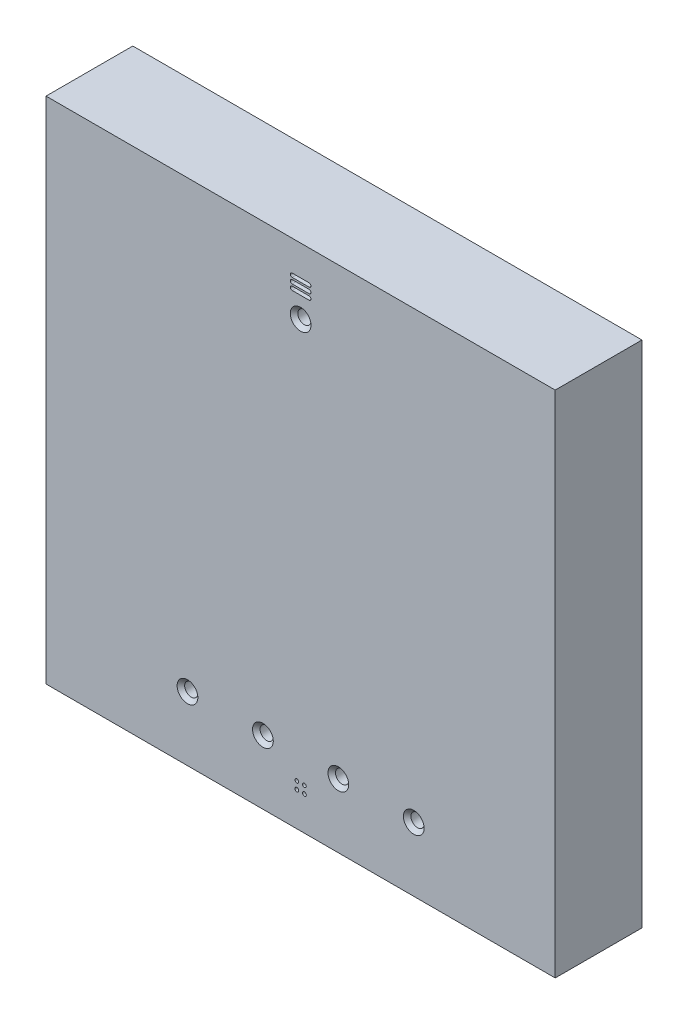
from build123d import *

# Parameters (mm, degrees)
SKIZZE1_W                       = 135
SKIZZE1_H                       = 135
SKIZZE1_W_2                     = 131
SKIZZE1_H_2                     = 131
AUFSATZ_LINEAR_AUSTRAGEN1_DEPTH = 18
SKIZZE2_W                       = 135
SKIZZE2_H                       = 135
AUFSATZ_LINEAR_AUSTRAGEN2_DEPTH = 5
SCHNITT_LINEAR_AUSTRAGEN1_DEPTH = 11
SKIZZE4_R                       = 1.75
SKIZZE4_R_2                     = 0.5
SCHNITT_LINEAR_AUSTRAGEN2_DEPTH = 10
FASE1_SIZE                      = 1


with BuildPart() as part:
    # Skizze1 → Aufsatz-Linear austragen1 (new body)
    with BuildSketch(Plane.XY):
        Rectangle(SKIZZE1_W, SKIZZE1_H)
        Rectangle(SKIZZE1_W_2, SKIZZE1_H_2, mode=Mode.SUBTRACT)
    extrude(amount=AUFSATZ_LINEAR_AUSTRAGEN1_DEPTH)

    # Skizze2 → Aufsatz-Linear austragen2 (add)
    with BuildSketch(Plane.XY.offset(18)):
        Rectangle(SKIZZE2_W, SKIZZE2_H)
    extrude(amount=AUFSATZ_LINEAR_AUSTRAGEN2_DEPTH)

    # Skizze3 → Schnitt-Linear austragen1 (cut)
    with BuildSketch(Plane.ZY.offset(67.5)):
        Polygon((5, -33.148996127), (3, -33.148996127), (3, -41.848996127), (5, -41.848996127), (7.4, -41.848996127), (7.4, -33.148996127), align=None)
    extrude(amount=-SCHNITT_LINEAR_AUSTRAGEN1_DEPTH, mode=Mode.SUBTRACT)

    # Skizze4 → Schnitt-Linear austragen2 (cut)
    with BuildSketch(Plane.XY.offset(23)):
        with BuildLine():
            Line((2.25, 56.5), (-2.25, 56.5))
            ThreePointArc((-2.25, 56.5), (-2.75, 56), (-2.25, 55.5))
            Line((-2.25, 55.5), (2.25, 55.5))
            ThreePointArc((2.25, 55.5), (2.75, 56), (2.25, 56.5))
        make_face()
        with BuildLine():
            Line((2.25, 58), (-2.25, 58))
            ThreePointArc((-2.25, 58), (-2.75, 57.5), (-2.25, 57))
            Line((-2.25, 57), (2.25, 57))
            ThreePointArc((2.25, 57), (2.75, 57.5), (2.25, 58))
        make_face()
        with BuildLine():
            Line((2.25, 59.5), (-2.25, 59.5))
            ThreePointArc((-2.25, 59.5), (-2.75, 59), (-2.25, 58.5))
            Line((-2.25, 58.5), (2.25, 58.5))
            ThreePointArc((2.25, 58.5), (2.75, 59), (2.25, 59.5))
        make_face()
        with Locations((0, 50)):
            Circle(SKIZZE4_R)
        with Locations((30, -50.5)):
            Circle(SKIZZE4_R)
        with Locations((10, -50.5)):
            Circle(SKIZZE4_R)
        with Locations((-10, -50.5)):
            Circle(SKIZZE4_R)
        with Locations((-30, -50.5)):
            Circle(SKIZZE4_R)
        with Locations((1, -56.5)):
            Circle(SKIZZE4_R_2)
        with Locations((1, -58.5)):
            Circle(SKIZZE4_R_2)
        with Locations((-1, -58.5)):
            Circle(SKIZZE4_R_2)
        with Locations((-1, -56.5)):
            Circle(SKIZZE4_R_2)
    extrude(amount=-SCHNITT_LINEAR_AUSTRAGEN2_DEPTH, mode=Mode.SUBTRACT)

    # Fase1
    fase1_edges = [part.edges().sort_by_distance(p)[0] for p in [
        (8.25, -50.5, 23),
        (-11.75, -50.5, 23),
        (-31.75, -50.5, 23),
        (28.25, -50.5, 23),
        (-1.75, 50, 23),
    ]]
    chamfer(fase1_edges, length=FASE1_SIZE)


solid = part.part
